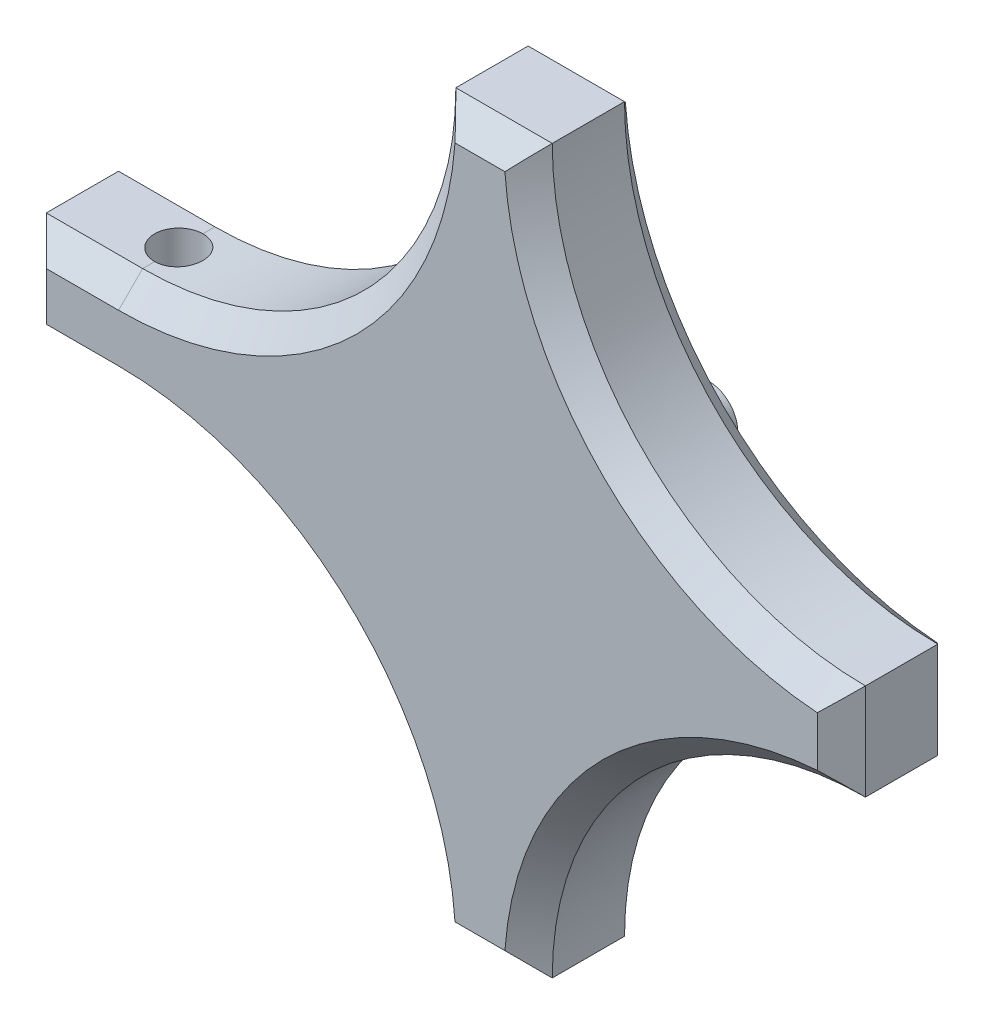
from build123d import *

# Parameters (mm, degrees)
SKETCH_1_W          = 170
SKETCH_1_H          = 150
EXTRUDE_1_DEPTH     = 25
CUT_EXTRUDE_1_DEPTH = 50
CHAMFER_2_SIZE      = 5
SKETCH_7_R          = 6
EXTRUDE_4_DEPTH     = 10
CHAMFER_4_SIZE      = 5
SKETCH_8_R          = 5
CUT_EXTRUDE_2_DEPTH = 229.089894559


with BuildPart() as part:
    # 草图1 → 凸台-拉伸1 (new body)
    with BuildSketch(Plane.XY):
        with Locations((85, -75)):
            Rectangle(SKETCH_1_W, SKETCH_1_H)
    extrude(amount=EXTRUDE_1_DEPTH)

    # 草图3 → 切除-拉伸1 (cut)
    with BuildSketch(Plane(origin=(0, 0, 0), x_dir=(-1, 0, 0), z_dir=(0, 0, -1))):
        with BuildLine():
            Line((-170, 0), (-105, 0))
            ThreePointArc((-105, 0), (-215.961940777, 45.961940777), (-170, -65))
            Line((-170, -65), (-170, 0))
        make_face()
        with BuildLine():
            ThreePointArc((-170, -65), (-124.038059223, -45.961940777), (-105, 0))
            Line((-105, 0), (-170, 0))
            Line((-170, 0), (-170, -65))
        make_face()
        with BuildLine():
            ThreePointArc((0, -61.846584384), (18.242646352, 52.559490104), (-85, 0))
            Line((-85, 0), (-20, 0))
            Line((-20, 0), (0, 0))
            Line((0, 0), (0, -61.846584384))
        make_face()
        with BuildLine():
            Line((-20, 0), (-85, 0))
            ThreePointArc((-85, 0), (-65.961940777, -45.961940777), (-20, -65))
            Line((-20, -65), (0, -65))
            Line((0, -65), (0, -61.846584384))
            Line((0, -61.846584384), (0, 0))
            Line((0, 0), (-20, 0))
        make_face()
        with BuildLine():
            Line((0, -150), (-85, -150))
            ThreePointArc((-85, -150), (18.242646352, -202.559490104), (0, -88.153415616))
            Line((0, -88.153415616), (0, -150))
        make_face()
        with BuildLine():
            Line((0, -88.153415616), (0, -85))
            Line((0, -85), (-20, -85))
            ThreePointArc((-20, -85), (-65.961940777, -104.038059223), (-85, -150))
            Line((-85, -150), (0, -150))
            Line((0, -150), (0, -88.153415616))
        make_face()
        with BuildLine():
            Line((-170, -150), (-170, -85))
            ThreePointArc((-170, -85), (-215.961940777, -195.961940777), (-105, -150))
            Line((-105, -150), (-170, -150))
        make_face()
        with BuildLine():
            ThreePointArc((-105, -150), (-124.038059223, -104.038059223), (-170, -85))
            Line((-170, -85), (-170, -150))
            Line((-170, -150), (-105, -150))
        make_face()
    extrude(amount=-CUT_EXTRUDE_1_DEPTH, mode=Mode.SUBTRACT)

    # 倒角2
    chamfer_2_edges = [part.edges().sort_by_distance(p)[0] for p in [
        (0, -75, 0),
        (95, 0, 0),
        (170, -75, 0),
        (95, -150, 0),
        (124.038059223, -45.961940777, 0),
        (65.961940777, -45.961940777, 0),
        (124.038059223, -104.038059223, 0),
        (65.961940777, -104.038059223, 0),
        (10, -85, 0),
        (10, -65, 0),
    ]]
    chamfer(chamfer_2_edges, length=CHAMFER_2_SIZE)

    # 草图7 → 凸台-拉伸4 (add)
    with BuildSketch(Plane(origin=(0, 0, 0), x_dir=(-1, 0, 0), z_dir=(0, 0, -1))):
        with Locations(Location((-107.5, -62.5, 0), (0, 0, 180))):
            Circle(SKETCH_7_R)
        with Locations(Location((-82.5, -62.5, 0), (0, 0, 180))):
            Circle(SKETCH_7_R)
        with Locations(Location((-82.5, -87.5, 0), (0, 0, 180))):
            Circle(SKETCH_7_R)
        with Locations(Location((-107.5, -87.5, 0), (0, 0, 180))):
            Circle(SKETCH_7_R)
    extrude(amount=EXTRUDE_4_DEPTH)

    # 倒角4
    chamfer_4_edges = [part.edges().sort_by_distance(p)[0] for p in [
        (0, -75, 25),
        (95, -150, 25),
        (170, -75, 25),
        (95, 0, 25),
        (124.038059223, -104.038059223, 25),
        (10, -85, 25),
        (65.961940777, -104.038059223, 25),
        (10, -65, 25),
        (65.961940777, -45.961940777, 25),
        (124.038059223, -45.961940777, 25),
    ]]
    chamfer(chamfer_4_edges, length=CHAMFER_4_SIZE)

    # 草图8 → 切除-拉伸2 (cut, through all)
    with BuildSketch(Plane(origin=(0, 0, 0), x_dir=(1, 0, 0), z_dir=(0, 1, 0))):
        with Locations(Location((20, -12.5, 0), (0, 0, 270))):
            Circle(SKETCH_8_R)
    extrude(amount=-CUT_EXTRUDE_2_DEPTH, mode=Mode.SUBTRACT)


solid = part.part
